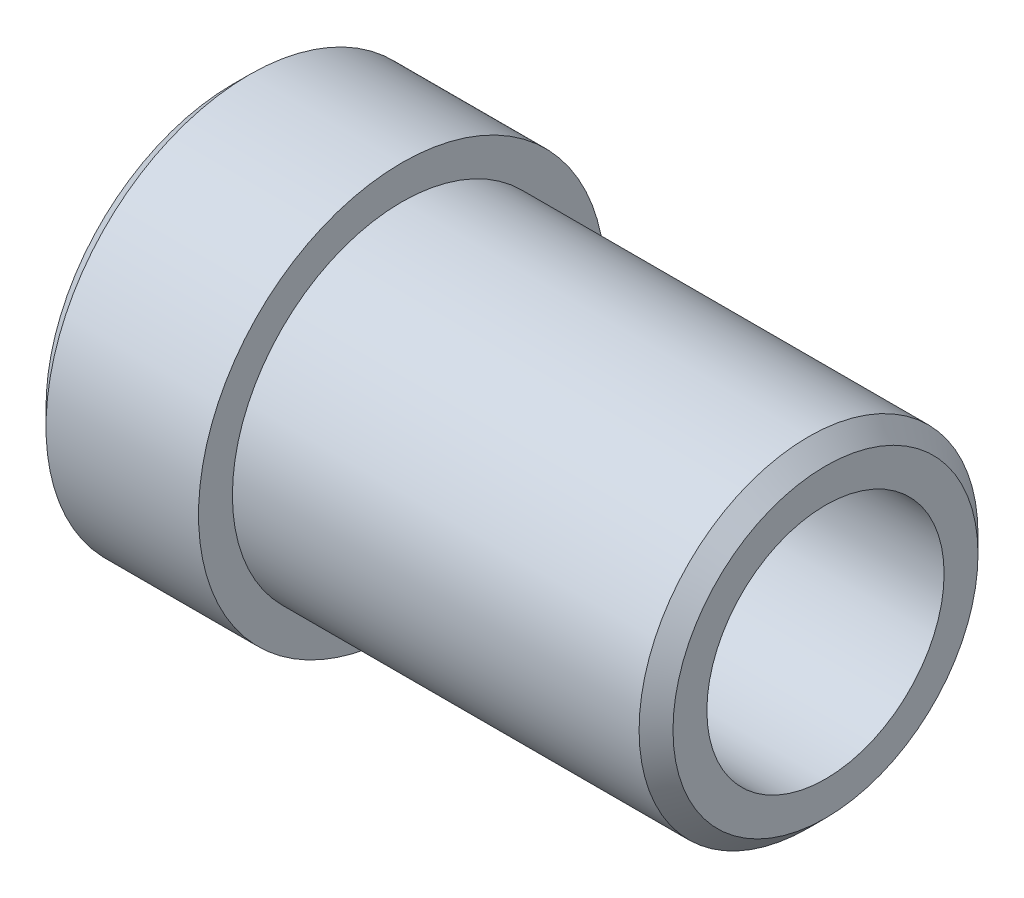
from build123d import *

# Parameters (mm, degrees)
SKETCH3_R          = 7
CUT_EXTRUDE1_DEPTH = 39.897300678
CHAMFER1_SIZE      = 1


with BuildPart() as part:
    # Sketch1 → Revolve1 (revolve)
    with BuildSketch(Plane.XY, mode=Mode.PRIVATE) as revolve1_sk:
        Polygon((0, 0), (0, -10), (-25, -10), (-25, -12), (-35, -12), (-35, 0), align=None)
    revolve(revolve1_sk.sketch.rotate(Axis((0, 0, 0), (-1, 0, 0)), 180), axis=Axis((0, 0, 0), (-1, 0, 0)))

    # Sketch3 → Cut-Extrude1 (cut, through all)
    with BuildSketch(Plane(origin=(0, 0, 0), x_dir=(0, 0, -1), z_dir=(1, 0, 0))):
        with Locations(Location((0, 0, 0), (0, 0, 90))):
            Circle(SKETCH3_R)
    extrude(amount=-CUT_EXTRUDE1_DEPTH, mode=Mode.SUBTRACT)

    # Chamfer1
    chamfer1_edges = [part.edges().sort_by_distance(p)[0] for p in [
        (-35, -12, 0),
        (0, -10, 0),
    ]]
    chamfer(chamfer1_edges, length=CHAMFER1_SIZE)


solid = part.part
